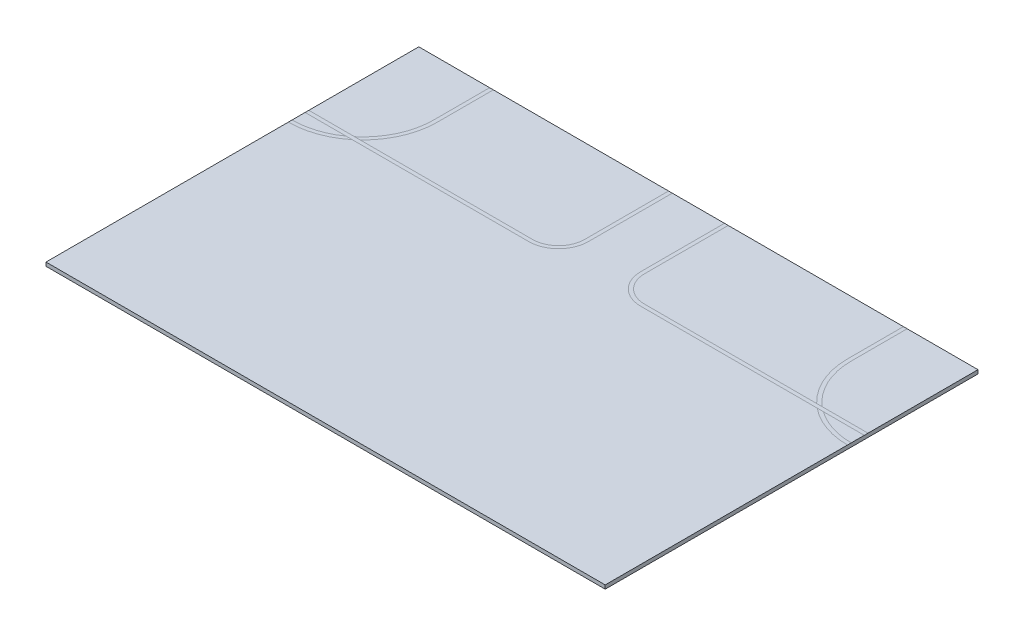
from build123d import *

# Parameters (mm, degrees)
ESQUISSE1_W        = 3000
ESQUISSE1_H        = 2000
BOSS_EXTRU_1_DEPTH = 20
BOSS_EXTRU_2_DEPTH = 0.0001
BOSS_EXTRU_6_DEPTH = 0.0002
ESQUISSE6_W        = 20
ESQUISSE6_H        = 300
BOSS_EXTRU_8_DEPTH = 0.0002
ESQUISSE7_W        = 20
ESQUISSE7_H        = 450
ESQUISSE7_W_2      = 1200
ESQUISSE7_H_2      = 20
BOSS_EXTRU_9_DEPTH = 0.0003


with BuildPart() as part:
    # Esquisse1 → Boss.-Extru.1 (new body)
    with BuildSketch(Plane(origin=(0, 0, 0), x_dir=(1, 0, 0), z_dir=(0, 1, 0))):
        with Locations((1366.565464178, -917.954094264)):
            Rectangle(ESQUISSE1_W, ESQUISSE1_H)
    extrude(amount=BOSS_EXTRU_1_DEPTH)

    # Esquisse2 → Boss.-Extru.2 (add)
    with BuildSketch(Plane(origin=(0, 20, 0), x_dir=(1, 0, 0), z_dir=(0, 1, 0))):
        with BuildLine():
            Line((2466.565464178, 82.045905736), (266.565464178, 82.045905736))
            Line((266.565464178, 82.045905736), (266.565464178, -217.954094264))
            ThreePointArc((266.565464178, -217.954094264), (149.408176652, -500.796806738), (-133.434535822, -617.954094264))
            Line((-133.434535822, -617.954094264), (-133.434535822, -1917.954094264))
            Line((-133.434535822, -1917.954094264), (2866.565464178, -1917.954094264))
            Line((2866.565464178, -1917.954094264), (2866.565464178, -617.954094264))
            ThreePointArc((2866.565464178, -617.954094264), (2583.722751703, -500.796806738), (2466.565464178, -217.954094264))
            Line((2466.565464178, -217.954094264), (2466.565464178, 82.045905736))
        make_face()
    extrude(amount=BOSS_EXTRU_2_DEPTH)

    # Esquisse5 → Boss.-Extru.6 (add)
    with BuildSketch(Plane(origin=(0, 20, 0), x_dir=(1, 0, 0), z_dir=(0, 1, 0))):
        with BuildLine():
            Line((266.565464178, 82.045905736), (246.565464178, 82.045905736))
            Line((246.565464178, 82.045905736), (246.565464178, -217.954094264))
            ThreePointArc((246.565464178, -217.954094264), (135.266041029, -486.654671115), (-133.434535822, -597.954094264))
            Line((-133.434535822, -597.954094264), (-133.434535822, -617.954094264))
            ThreePointArc((-133.434535822, -617.954094264), (149.408176652, -500.796806738), (266.565464178, -217.954094264))
            Line((266.565464178, -217.954094264), (266.565464178, 82.045905736))
        make_face()
    extrude(amount=BOSS_EXTRU_6_DEPTH)

    # Esquisse6 → Boss.-Extru.8 (add)
    with BuildSketch(Plane(origin=(0, 20, 0), x_dir=(1, 0, 0), z_dir=(0, 1, 0))):
        with BuildLine():
            Line((2486.565464178, -217.954094264), (2466.565464178, -217.954094264))
            ThreePointArc((2466.565464178, -217.954094264), (2583.722751703, -500.796806738), (2866.565464178, -617.954094264))
            Line((2866.565464178, -617.954094264), (2866.565464178, -597.954094264))
            ThreePointArc((2866.565464178, -597.954094264), (2597.864887327, -486.654671115), (2486.565464178, -217.954094264))
        make_face()
        with Locations((2476.565464178, -67.954094264)):
            Rectangle(ESQUISSE6_W, ESQUISSE6_H)
    extrude(amount=BOSS_EXTRU_8_DEPTH)

    # Esquisse7 → Boss.-Extru.9 (add)
    with BuildSketch(Plane(origin=(0, 20, 0), x_dir=(1, 0, 0), z_dir=(0, 1, 0))):
        with Locations((1216.565464178, -142.954094264)):
            Rectangle(ESQUISSE7_W, ESQUISSE7_H)
        with Locations((1516.565464178, -142.954094264)):
            Rectangle(ESQUISSE7_W, ESQUISSE7_H)
        with BuildLine():
            ThreePointArc((1526.565464178, -367.954094264), (1567.570514812, -466.94904363), (1666.565464178, -507.954094264))
            Line((1666.565464178, -507.954094264), (1666.565464178, -527.954094264))
            ThreePointArc((1666.565464178, -527.954094264), (1553.428379188, -481.091179254), (1506.565464178, -367.954094264))
            Line((1506.565464178, -367.954094264), (1526.565464178, -367.954094264))
        make_face()
        with BuildLine():
            ThreePointArc((1226.565464178, -367.954094264), (1179.702549168, -481.091179254), (1066.565464178, -527.954094264))
            Line((1066.565464178, -527.954094264), (1066.565464178, -507.954094264))
            ThreePointArc((1066.565464178, -507.954094264), (1165.560413544, -466.94904363), (1206.565464178, -367.954094264))
            Line((1206.565464178, -367.954094264), (1226.565464178, -367.954094264))
        make_face()
        with BuildLine():
            Line((1066.565464178, -507.954094264), (112.126047334, -507.954094264))
            ThreePointArc((112.126047334, -507.954094264), (99.44686126, -518.231057904), (86.338073936, -527.954094264))
            Line((86.338073936, -527.954094264), (1066.565464178, -527.954094264))
            Line((1066.565464178, -527.954094264), (1066.565464178, -507.954094264))
        make_face()
        with Locations((2266.565464178, -517.954094264)):
            Rectangle(ESQUISSE7_W_2, ESQUISSE7_H_2)
        with BuildLine():
            Line((112.126047334, -507.954094264), (-133.434535822, -507.954094264))
            Line((-133.434535822, -507.954094264), (-133.434535822, -527.954094264))
            Line((-133.434535822, -527.954094264), (86.338073936, -527.954094264))
            ThreePointArc((86.338073936, -527.954094264), (99.44686126, -518.231057904), (112.126047334, -507.954094264))
        make_face()
    extrude(amount=BOSS_EXTRU_9_DEPTH)


solid = part.part
